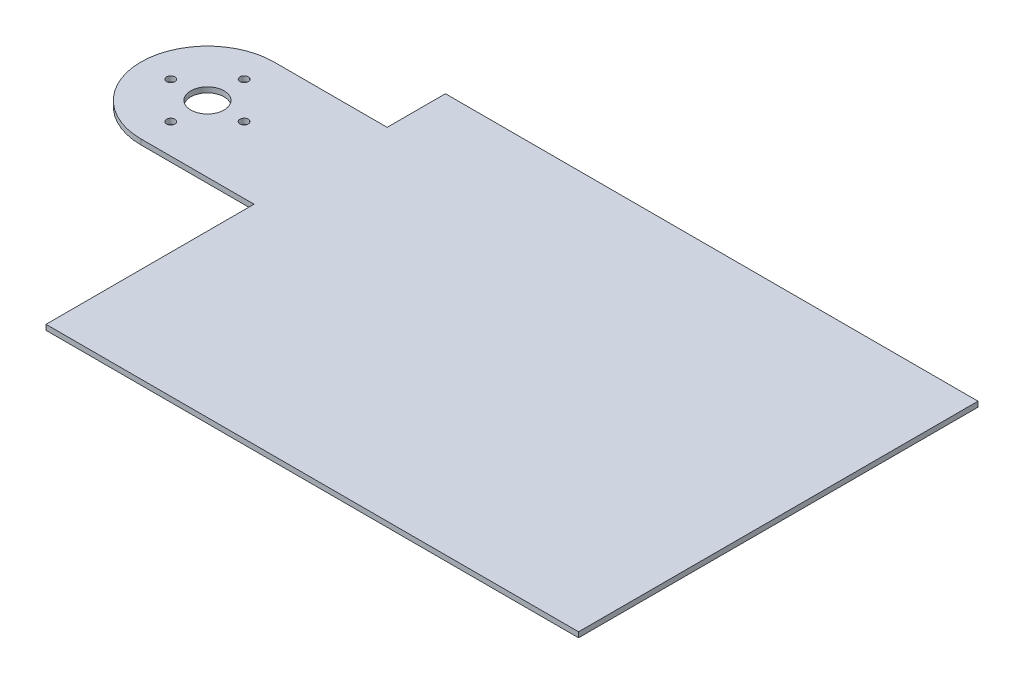
from build123d import *

# Parameters (mm, degrees)
SKETCH1_R           = 0.800000051
SKETCH1_R_2         = 3.175
BOSS_EXTRUDE1_DEPTH = 0.500000016


with BuildPart() as part:
    # Sketch1 → Boss-Extrude1 (new, symmetric)
    with BuildSketch(Plane(origin=(0, 0, 0), x_dir=(1, 0, 0), z_dir=(0, 1, 0))):
        with BuildLine():
            Line((0, 12.7), (21.59, 12.7))
            Line((21.59, 12.7), (21.59, 23.8125))
            Line((21.59, 23.8125), (123.19, 23.8125))
            Line((123.19, 23.8125), (123.19, -52.3875))
            Line((123.19, -52.3875), (21.59, -52.3875))
            Line((21.59, -52.3875), (21.59, -12.7))
            Line((21.59, -12.7), (0, -12.7))
            ThreePointArc((0, -12.7), (-12.7, 0), (0, 12.7))
        make_face()
        with Locations(Location((6.99999997, 0, 0), (0, 0, 270))):
            Circle(SKETCH1_R, mode=Mode.SUBTRACT)
        with Locations(Location((0, -6.99999997, 0), (0, 0, 270))):
            Circle(SKETCH1_R, mode=Mode.SUBTRACT)
        with Locations(Location((-6.99999997, 0, 0), (0, 0, 270))):
            Circle(SKETCH1_R, mode=Mode.SUBTRACT)
        with Locations(Location((0, 6.99999997, 0), (0, 0, 270))):
            Circle(SKETCH1_R, mode=Mode.SUBTRACT)
        with Locations(Location((0, 0, 0), (0, 0, 270))):
            Circle(SKETCH1_R_2, mode=Mode.SUBTRACT)
    extrude(amount=BOSS_EXTRUDE1_DEPTH, both=True)


solid = part.part
